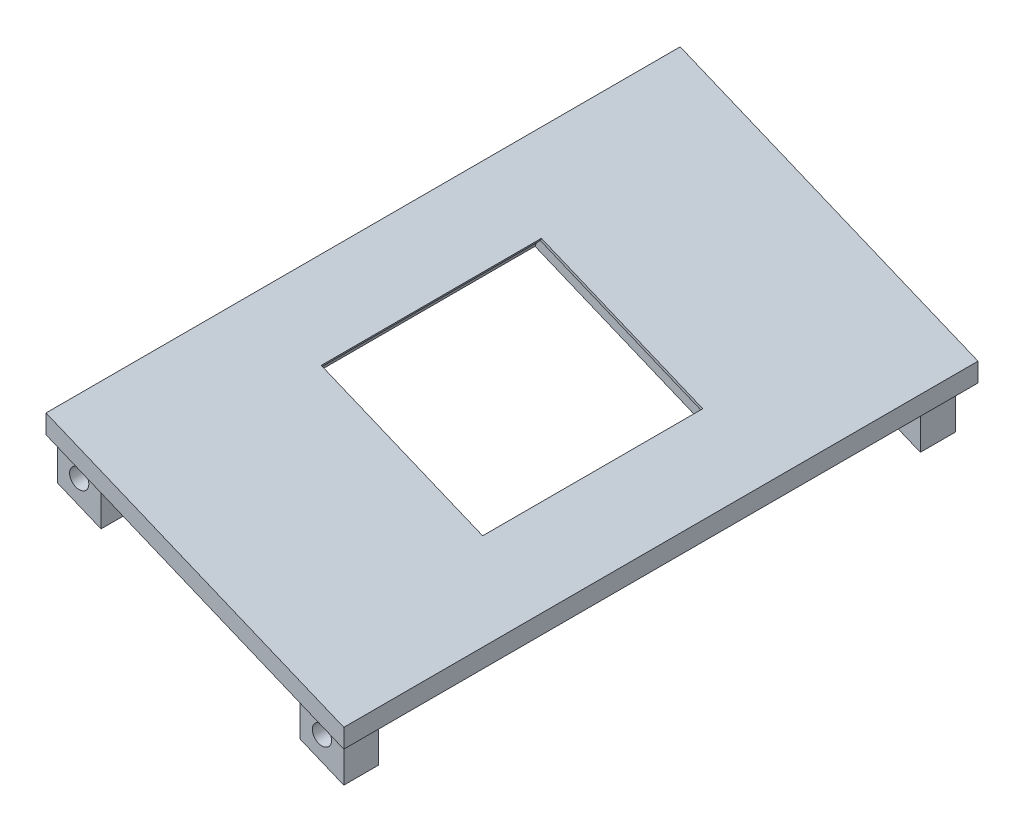
from build123d import *

# Parameters (mm, degrees)
AUFSATZ_LINEAR_AUSTRAGEN1_DEPTH = 145.2
AUFSATZ_LINEAR_AUSTRAGEN2_DEPTH = 145.2
SKIZZE5_R                       = 2.2
SCHNITT_LINEAR_AUSTRAGEN1_DEPTH = 165.848511541
SCHNITT_LINEAR_AUSTRAGEN2_REACH = 166.605
SKIZZE6_W                       = 76.784770152
SKIZZE6_H                       = 124
SKIZZE6_H_2                     = 2.6
SKIZZE7_W                       = 40
SKIZZE7_H                       = 50.4
SCHNITT_LINEAR_AUSTRAGEN3_DEPTH = 166.115329215
SKIZZE8_W                       = 42
SKIZZE8_H                       = 57.4
SCHNITT_LINEAR_AUSTRAGEN4_DEPTH = 3.4


with BuildPart() as part:
    # Skizze1 → Aufsatz-Linear austragen1 (new body)
    with BuildSketch(Plane.XY):
        Polygon((0, 0), (0, 4.329568801), (68.182309499, -23.912468507), (68.182309499, -28.242037309), align=None)
    extrude(amount=AUFSATZ_LINEAR_AUSTRAGEN1_DEPTH)

    # Skizze4 → Aufsatz-Linear austragen2 (add)
    with BuildSketch(Plane.XY.offset(145.2)):
        Polygon((0, 0), (10, -4.142135624), (10, -14.966057627), (0, -10.823922003), align=None)
        Polygon((55.582309499, -23.022946423), (65.582309499, -27.165082046), (65.582309499, -37.989004049), (55.582309499, -33.846868426), align=None)
    extrude(amount=-AUFSATZ_LINEAR_AUSTRAGEN2_DEPTH)

    # Skizze5 → Schnitt-Linear austragen1 (cut, through all)
    with BuildSketch(Plane.XY.offset(145.2)):
        with Locations((5, -7.483028813)):
            Circle(SKIZZE5_R)
        with Locations((60.582309499, -30.505975236)):
            Circle(SKIZZE5_R)
    extrude(amount=-SCHNITT_LINEAR_AUSTRAGEN1_DEPTH, mode=Mode.SUBTRACT)

    # Schnitt-Linear austragen2: up to this face of the body (flat: up to its plane)
    schnitt_linear_austragen2_end = Plane(part.part.faces().sort_by_distance((32.79115475, -13.582541023, 72.6))[0])
    # Skizze6 → Schnitt-Linear austragen2 (cut, up to the picked face)
    with BuildSketch(Plane(origin=(-3.826834324, -9.238795325, 0), x_dir=(0.9238795325112881, -0.3826834323650869, 0), z_dir=(-0.3826834323650869, -0.9238795325112881, 0)), mode=Mode.PRIVATE) as schnitt_linear_austragen2_sk1:
        with Locations((36.735530827, 72.6)):
            Rectangle(SKIZZE6_W, SKIZZE6_H)
    schnitt_linear_austragen2_tool1 = split(extrude(schnitt_linear_austragen2_sk1.sketch, amount=-SCHNITT_LINEAR_AUSTRAGEN2_REACH, mode=Mode.PRIVATE), bisect_by=schnitt_linear_austragen2_end, keep=Keep.BOTH, mode=Mode.PRIVATE)
    # Skizze6 → Schnitt-Linear austragen2 (cut, up to the picked face)
    with BuildSketch(Plane(origin=(-3.826834324, -9.238795325, 0), x_dir=(0.9238795325112881, -0.3826834323650869, 0), z_dir=(-0.3826834323650869, -0.9238795325112881, 0)), mode=Mode.PRIVATE) as schnitt_linear_austragen2_sk2:
        with Locations((36.735530827, 143.9)):
            Rectangle(SKIZZE6_W, SKIZZE6_H_2)
    schnitt_linear_austragen2_tool2 = split(extrude(schnitt_linear_austragen2_sk2.sketch, amount=-SCHNITT_LINEAR_AUSTRAGEN2_REACH, mode=Mode.PRIVATE), bisect_by=schnitt_linear_austragen2_end, keep=Keep.BOTH, mode=Mode.PRIVATE)
    # Skizze6 → Schnitt-Linear austragen2 (cut, up to the picked face)
    with BuildSketch(Plane(origin=(-3.826834324, -9.238795325, 0), x_dir=(0.9238795325112881, -0.3826834323650869, 0), z_dir=(-0.3826834323650869, -0.9238795325112881, 0)), mode=Mode.PRIVATE) as schnitt_linear_austragen2_sk3:
        with Locations((36.735530827, 1.3)):
            Rectangle(SKIZZE6_W, SKIZZE6_H_2)
    schnitt_linear_austragen2_tool3 = split(extrude(schnitt_linear_austragen2_sk3.sketch, amount=-SCHNITT_LINEAR_AUSTRAGEN2_REACH, mode=Mode.PRIVATE), bisect_by=schnitt_linear_austragen2_end, keep=Keep.BOTH, mode=Mode.PRIVATE)
    add(schnitt_linear_austragen2_tool1.solids().sort_by(Axis((30.112371, -23.296874, 72.6), (0.3826834323650869, 0.9238795325112881, 0)))[0], mode=Mode.SUBTRACT)
    add(schnitt_linear_austragen2_tool2.solids().sort_by(Axis((30.112371, -23.296874, 143.9), (0.3826834323650869, 0.9238795325112881, 0)))[0], mode=Mode.SUBTRACT)
    add(schnitt_linear_austragen2_tool3.solids().sort_by(Axis((30.112371, -23.296874, 1.3), (0.3826834323650869, 0.9238795325112881, 0)))[0], mode=Mode.SUBTRACT)

    # Skizze7 → Schnitt-Linear austragen3 (cut, through all)
    with BuildSketch(Plane(origin=(1.530733729, 3.69551813, 0), x_dir=(0.9238795325112881, -0.38268343236508656, 0), z_dir=(0.38268343236508656, 0.9238795325112881, 0))):
        with Locations((35.243145751, -72.6)):
            Rectangle(SKIZZE7_W, SKIZZE7_H)
    extrude(amount=-SCHNITT_LINEAR_AUSTRAGEN3_DEPTH, mode=Mode.SUBTRACT)

    # Skizze8 → Schnitt-Linear austragen4 (cut)
    with BuildSketch(Plane(origin=(0, 0, 0), x_dir=(0.923879532511288, -0.38268343236508684, 0), z_dir=(-0.38268343236508684, -0.923879532511288, 0))):
        with Locations((35.243145751, 75.1)):
            Rectangle(SKIZZE8_W, SKIZZE8_H)
    extrude(amount=-SCHNITT_LINEAR_AUSTRAGEN4_DEPTH, mode=Mode.SUBTRACT)


solid = part.part
